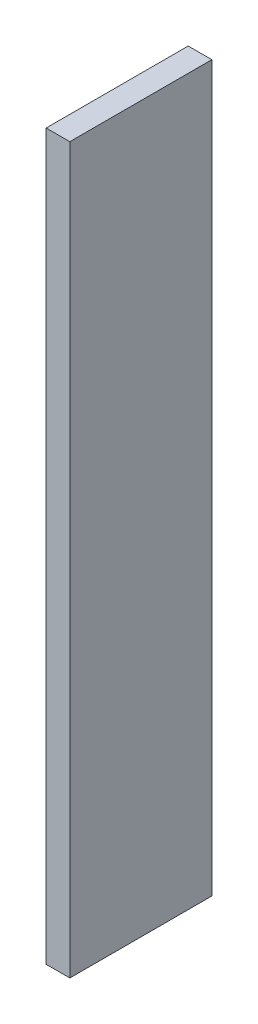
from build123d import *

# Parameters (mm, degrees)
SKETCH_1_W      = 5
SKETCH_1_H      = 30
EXTRUDE_1_DEPTH = 153


with BuildPart() as part:
    # Эскиз1 → Бобышка-Вытянуть1 (new body)
    with BuildSketch(Plane(origin=(0, 0, 0), x_dir=(1, 0, 0), z_dir=(0, 1, 0))):
        with Locations((2.5, -15)):
            Rectangle(SKETCH_1_W, SKETCH_1_H)
    extrude(amount=EXTRUDE_1_DEPTH)


solid = part.part
